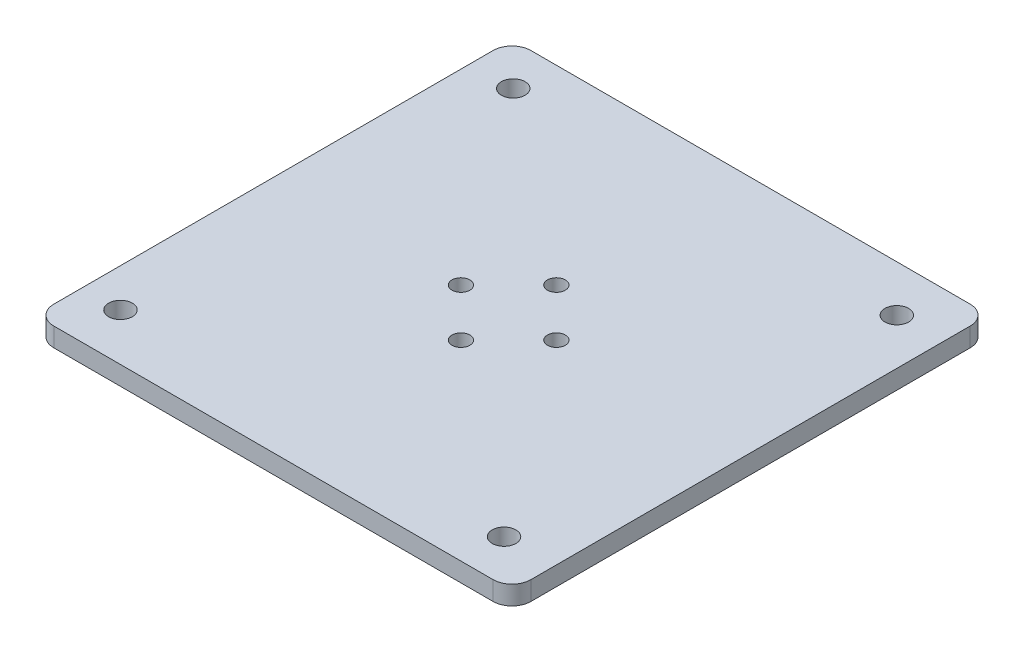
from build123d import *

# Parameters (mm, degrees)
SKETCH1_W           = 80
SKETCH1_H           = 80
BOSS_EXTRUDE1_DEPTH = 3.175
SKETCH16_R          = 1.984375
CUT_EXTRUDE8_DEPTH  = 10
FILLET1_R           = 3.175
SKETCH21_R          = 1.5
CUT_EXTRUDE9_DEPTH  = 10


with BuildPart() as part:
    # Sketch1 → Boss-Extrude1 (new body)
    with BuildSketch(Plane(origin=(0, 0, 0), x_dir=(1, 0, 0), z_dir=(0, 1, 0))):
        Rectangle(SKETCH1_W, SKETCH1_H)
    extrude(amount=BOSS_EXTRUDE1_DEPTH)

    # Sketch16 → Cut-Extrude8 (cut)
    with BuildSketch(Plane(origin=(0, 3.175, 0), x_dir=(1, 0, 0), z_dir=(0, 1, 0))):
        with Locations(Location((-32.800817373, 33.005763026, 0), (0, 0, 270))):
            Circle(SKETCH16_R)
        with Locations(Location((32.282136008, 32.236454615, 0), (0, 0, 270))):
            Circle(SKETCH16_R)
        with Locations(Location((31.512827597, -32.846498766, 0), (0, 0, 270))):
            Circle(SKETCH16_R)
        with Locations(Location((-33.570125785, -32.077190355, 0), (0, 0, 270))):
            Circle(SKETCH16_R)
    extrude(amount=-CUT_EXTRUDE8_DEPTH, mode=Mode.SUBTRACT)

    # Fillet1
    fillet1_edges = [part.edges().sort_by_distance(p)[0] for p in [
        (-40, 1.5875, -40),
        (40, 1.5875, -40),
        (40, 1.5875, 40),
        (-40, 1.5875, 40),
    ]]
    fillet(fillet1_edges, radius=FILLET1_R)

    # Sketch21 → Cut-Extrude9 (cut)
    with BuildSketch(Plane.XZ):
        with Locations(Location((-0.64, 7.92, 0), (0, 0, 270))):
            Circle(SKETCH21_R)
        with Locations(Location((7.36, -0.08, 0), (0, 0, 270))):
            Circle(SKETCH21_R)
        with Locations(Location((-0.64, -8.08, 0), (0, 0, 270))):
            Circle(SKETCH21_R)
        with Locations(Location((-8.64, -0.08, 0), (0, 0, 270))):
            Circle(SKETCH21_R)
    extrude(amount=-CUT_EXTRUDE9_DEPTH, mode=Mode.SUBTRACT)


solid = part.part
